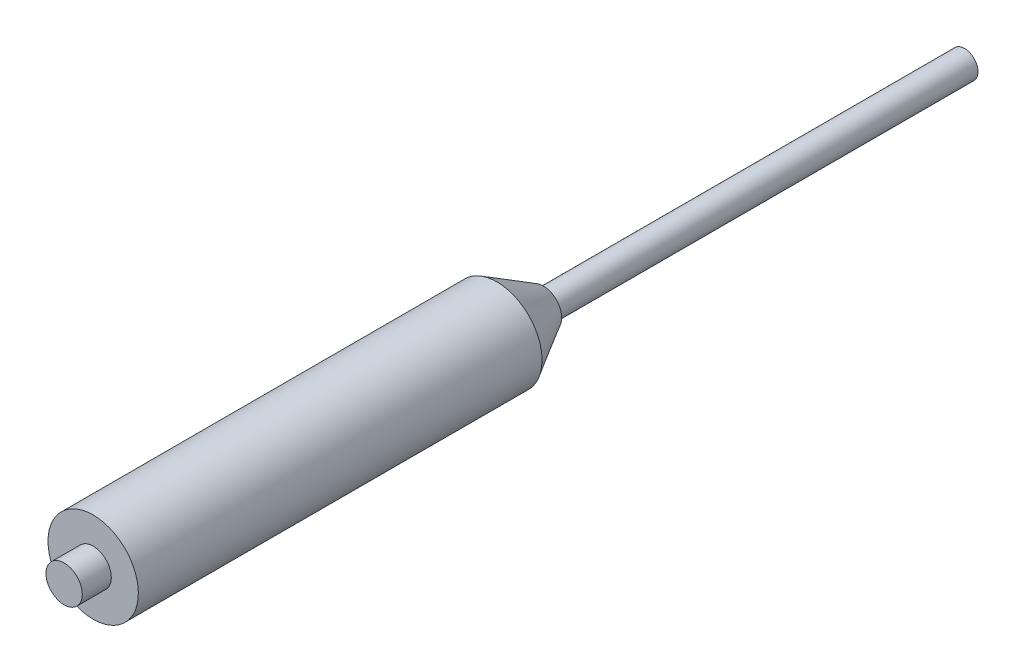
from build123d import *

# Parameters (mm, degrees)
SKETCH1_R           = 3.9497
BOSS_EXTRUDE1_DEPTH = 78.74
CUT_EXTRUDE1_START  = -2.54
SKETCH2_R           = 3.9497
SKETCH2_R_2         = 1.5875
CUT_EXTRUDE1_DEPTH  = 2.54
SKETCH4_R           = 3.9497
SKETCH4_R_2         = 1.1811
CUT_EXTRUDE3_DEPTH  = 36.83
CHAMFER1_SIZE       = 4.064
CHAMFER1_SIZE2      = 2.346351494


with BuildPart() as part:
    # Sketch1 → Boss-Extrude1 (new body)
    with BuildSketch(Plane.XY):
        Circle(SKETCH1_R)
    extrude(amount=BOSS_EXTRUDE1_DEPTH)

    # Sketch2 → Cut-Extrude1 (cut)
    with BuildSketch(Plane.XY.offset(78.74).offset(CUT_EXTRUDE1_START)):
        Circle(SKETCH2_R)
        Circle(SKETCH2_R_2, mode=Mode.SUBTRACT)
    extrude(amount=CUT_EXTRUDE1_DEPTH, mode=Mode.SUBTRACT)

    # Sketch4 → Cut-Extrude3 (cut)
    with BuildSketch(Plane(origin=(0, 0, 0), x_dir=(-1, 0, 0), z_dir=(0, 0, -1))):
        Circle(SKETCH4_R)
        Circle(SKETCH4_R_2, mode=Mode.SUBTRACT)
    extrude(amount=-CUT_EXTRUDE3_DEPTH, mode=Mode.SUBTRACT)

    # Chamfer1
    chamfer1_edges = [part.edges().sort_by_distance(p)[0] for p in [
        (-3.9497, 0, 36.83),
    ]]
    chamfer1_side = [part.faces().sort_by_distance(p)[0] for p in [
        (-3.9497, 0, 56.515),
    ]]
    chamfer(chamfer1_edges, length=CHAMFER1_SIZE, length2=CHAMFER1_SIZE2, reference=chamfer1_side[0])


solid = part.part
